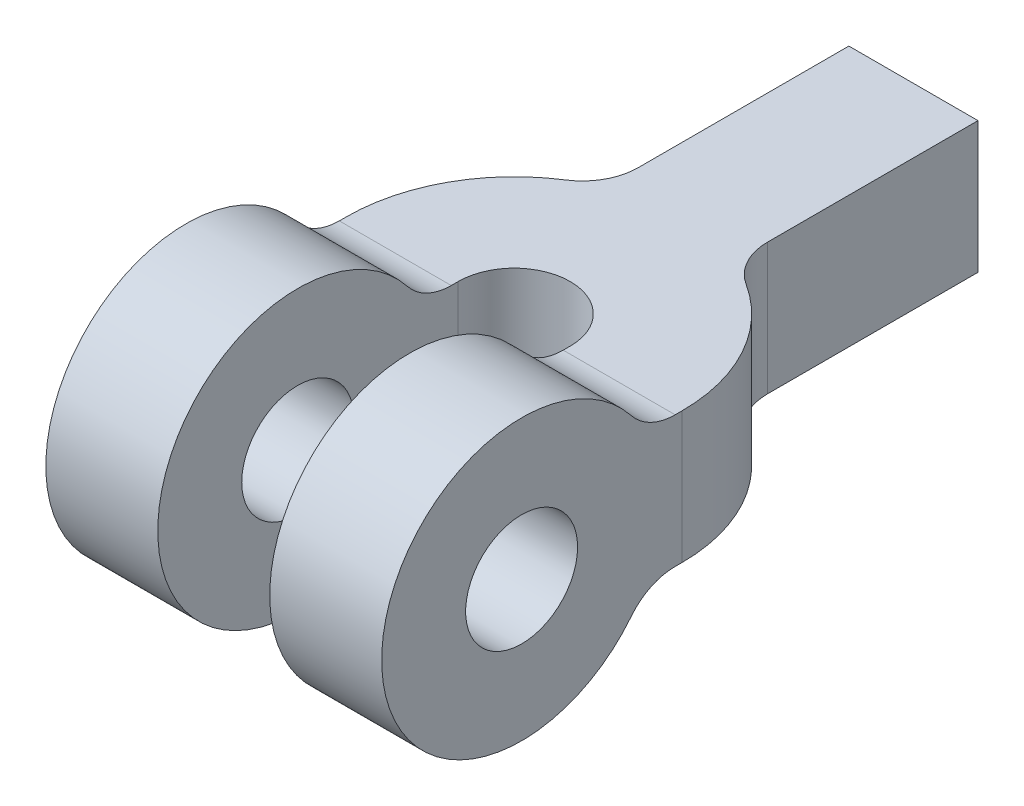
from build123d import *

# Parameters (mm, degrees)
SKETCH2_W           = 120
SKETCH2_H           = 250
BOSS_EXTRUDE1_DEPTH = 100
SKETCH4_R           = 20
CUT_EXTRUDE1_DEPTH  = 100
SKETCH5_R           = 20
CUT_EXTRUDE5_DEPTH  = 201.062490237


with BuildPart() as part:
    # Sketch2 → Boss-Extrude1 (new body)
    with BuildSketch(Plane(origin=(0, 0, 0), x_dir=(1, 0, 0), z_dir=(0, 1, 0))):
        Rectangle(SKETCH2_W, SKETCH2_H)
    extrude(amount=BOSS_EXTRUDE1_DEPTH)

    # Sketch4 → Cut-Extrude1 (cut)
    with BuildSketch(Plane(origin=(0, 100, 0), x_dir=(1, 0, 0), z_dir=(0, 1, 0))):
        with BuildLine():
            Line((-60, 125), (-60, -17.644609552))
            ThreePointArc((-60, -17.644609552), (-52.622366518, 11.180492718), (-32.303782241, 32.916893747))
            ThreePointArc((-32.303782241, 32.916893747), (-25.530920786, 40.16236081), (-23.071709655, 49.770728302))
            Line((-23.071709655, 49.770728302), (-23.071709655, 125))
            Line((-23.071709655, 125), (-60, 125))
        make_face()
        with BuildLine():
            ThreePointArc((32.303782241, 32.916893747), (52.62236667, 11.18049244), (60, -17.644610185))
            Line((60, -17.644610185), (60, 125))
            Line((60, 125), (23.071709655, 125))
            Line((23.071709655, 125), (23.071709655, 49.770728302))
            ThreePointArc((23.071709655, 49.770728302), (25.530920786, 40.16236081), (32.303782241, 32.916893747))
        make_face()
        with Locations((0, -17.644609919)):
            Circle(SKETCH4_R)
        with BuildLine():
            Line((-20, -17.644609919), (-20, -74.213152414))
            ThreePointArc((-20, -74.213152414), (0, -77.644609919), (20, -74.213152414))
            Line((20, -74.213152414), (20, -17.644609919))
            ThreePointArc((20, -17.644609919), (0, -37.644609919), (-20, -17.644609919))
        make_face()
        with BuildLine():
            Line((-20, -74.213152414), (-20, -125))
            Line((-20, -125), (20, -125))
            Line((20, -125), (20, -74.213152414))
            ThreePointArc((20, -74.213152414), (0, -77.644609919), (-20, -74.213152414))
        make_face()
    extrude(amount=-CUT_EXTRUDE1_DEPTH, mode=Mode.SUBTRACT)

    # Sketch5 → Cut-Extrude5 (cut, through all)
    # profile 1 of 2: a face of its own
    with BuildSketch(Plane(origin=(60, 0, 0), x_dir=(0, 0, -1), z_dir=(1, 0, 0))):
        Polygon((125, 100), (49.770728302, 100), (32.916893747, 100), (-17.644609919, 100), (-125, 100), (-125, 0), (-17.644609919, 0), (32.916893747, 0), (49.770728302, 0), (125, 0), align=None)
        with BuildLine():
            Line((125, 73.474979738), (125, 26.525020262))
            Line((125, 26.525020262), (-20.137206262, 26.525020262))
            ThreePointArc((-20.137206262, 26.525020262), (-28.84270867, 24.530970051), (-35.812290187, 18.946443044))
            ThreePointArc((-35.812290187, 18.946443044), (-125, 50), (-35.812290187, 81.053556956))
            ThreePointArc((-35.812290187, 81.053556956), (-28.84270867, 75.469029949), (-20.137206262, 73.474979738))
            Line((-20.137206262, 73.474979738), (125, 73.474979738))
        make_face(mode=Mode.SUBTRACT)
    # profile 2 of 2: a face of its own
    with BuildSketch(Plane(origin=(60, 0, 0), x_dir=(0, 0, -1), z_dir=(1, 0, 0))):
        with Locations((-75, 50)):
            Circle(SKETCH5_R)
    extrude(amount=-CUT_EXTRUDE5_DEPTH, mode=Mode.SUBTRACT)


with BuildPart() as cut_extrude5_kept_piece:
    # of the separate pieces the step leaves, the one the design keeps (cut_extrude5_pieces_kept)
    add(part.part.solids().sort_by_distance((23.071709655, 73.474979738, -125))[0])


solid = cut_extrude5_kept_piece.part
